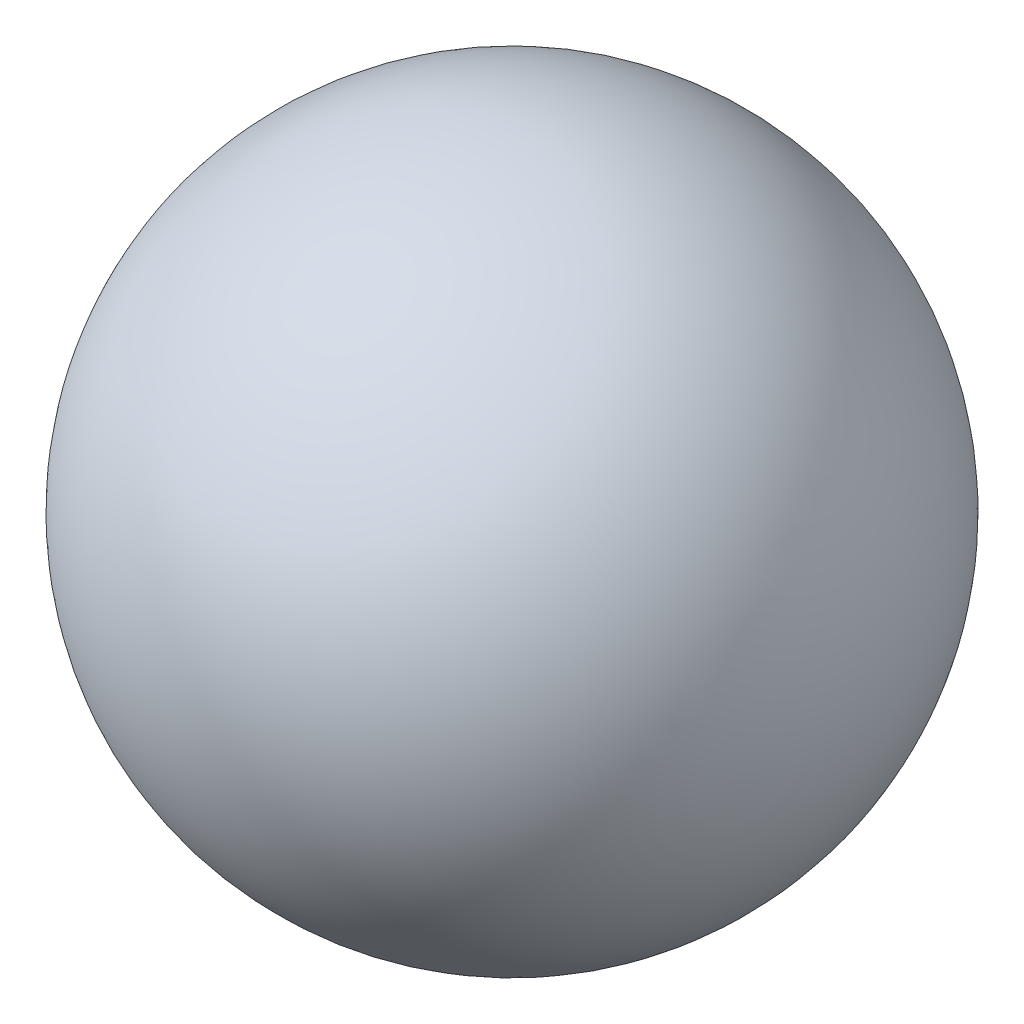
from build123d import *


with BuildPart() as part:
    # 草图1 → 旋转5 (revolve)
    with BuildSketch(Plane(origin=(0, 0, 0), x_dir=(1, 0, 0), z_dir=(0, 1, 0))):
        with BuildLine():
            Line((-120, 0), (120, 0))
            ThreePointArc((120, 0), (0, 120), (-120, 0))
        make_face()
    revolve(axis=Axis((0, 0, 0), (1, 0, 0)))


solid = part.part
